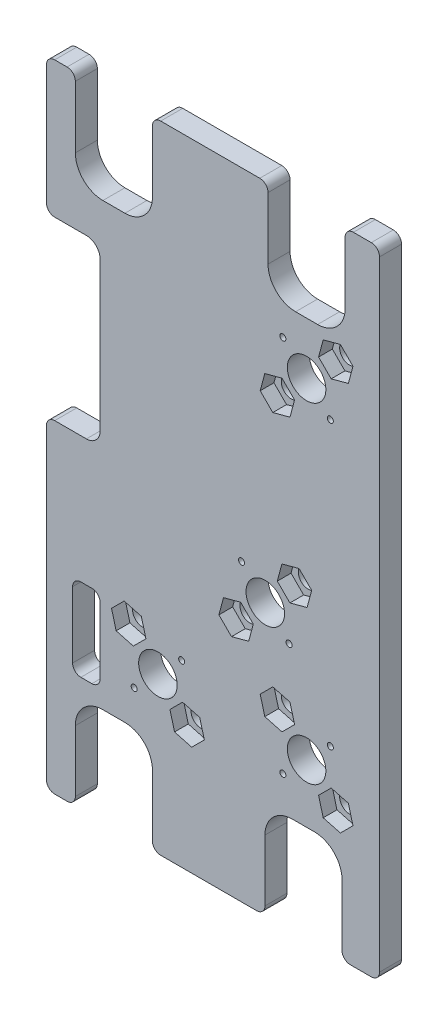
from build123d import *

# Parameters (mm, degrees)
SKETCH1_W           = 5
SKETCH1_H           = 15
SKETCH1_R           = 0.55
SKETCH1_R_2         = 3.5
BOSS_EXTRUDE1_DEPTH = 4
SKETCH2_R           = 1.8
CUT_EXTRUDE1_DEPTH  = 2.5
SKETCH4_R           = 1.8
CUT_EXTRUDE2_DEPTH  = 131.110049573
FILLET1_R           = 5
FILLET2_R           = 2.5
FILLET3_R           = 1.5
FILLET4_R           = 1.5


with BuildPart() as part:
    # Sketch1 → Boss-Extrude1 (new body)
    with BuildSketch(Plane.XY):
        Polygon((5.00009906, -115.25), (5.00009906, -111.60004858), (5.00009906, -97.60004858), (19.00009906, -97.60004858), (19.00009906, -111.60004858), (19.00009906, -115.25), (39.43509906, -115.25), (39.43509906, -111.60004858), (39.43509906, -97.60004858), (53.43509906, -97.60004858), (53.43509906, -111.60004858), (53.43509906, -115.25), (60.25, -115.25), (60.25, 0.25), (54.00009906, 0.25), (54.00009906, -3.50006858), (54.00009906, -17.50006858), (40.00009906, -17.50006858), (40.00009906, -3.50006858), (40.00009906, 0.25), (19.00009906, 0.25), (19.00009906, -3.50006858), (19.00009906, -17.50006858), (5.00009906, -17.50006858), (5.00009906, -3.50006858), (5.00009906, 0.25), (-0.25, 0.25), (-0.25, -24.5), (4.5, -24.5), (9.5, -24.5), (9.5, -41.5), (9.5, -56.5), (4.5, -56.5), (-0.25, -56.5), (-0.25, -115.25), align=None)
        with Locations((7, -87)):
            Rectangle(SKETCH1_W, SKETCH1_H, mode=Mode.SUBTRACT)
        with Locations((15.686582595, -91.313399625)):
            Circle(SKETCH1_R, mode=Mode.SUBTRACT)
        with Locations((19.99993396, -87.00004826)):
            Circle(SKETCH1_R_2, mode=Mode.SUBTRACT)
        with Locations((24.313285325, -82.686696895)):
            Circle(SKETCH1_R, mode=Mode.SUBTRACT)
        with Locations((42.686582595, -91.313399625)):
            Circle(SKETCH1_R, mode=Mode.SUBTRACT)
        with Locations((46.99993396, -87.00004826)):
            Circle(SKETCH1_R_2, mode=Mode.SUBTRACT)
        with Locations((35.186582595, -61.686696895)):
            Circle(SKETCH1_R, mode=Mode.SUBTRACT)
        with Locations((39.49993396, -66.00004826)):
            Circle(SKETCH1_R_2, mode=Mode.SUBTRACT)
        with Locations((43.813285325, -70.313399625)):
            Circle(SKETCH1_R, mode=Mode.SUBTRACT)
        with Locations((51.313285325, -82.686696895)):
            Circle(SKETCH1_R, mode=Mode.SUBTRACT)
        with Locations((51.313285325, -31.313399625)):
            Circle(SKETCH1_R, mode=Mode.SUBTRACT)
        with Locations((42.686582595, -22.686696895)):
            Circle(SKETCH1_R, mode=Mode.SUBTRACT)
        with Locations((46.99993396, -27.00004826)):
            Circle(SKETCH1_R_2, mode=Mode.SUBTRACT)
    extrude(amount=BOSS_EXTRUDE1_DEPTH)

    # Sketch2 → Cut-Extrude1 (cut)
    # profile 1 of 8: a face of its own
    with BuildSketch(Plane.XY.offset(4)):
        Polygon((26.140038593, -95.42634332), (28.42622902, -93.140152893), (27.589425245, -90.017158692), (24.466431045, -89.180354918), (22.180240618, -91.466545345), (23.017044392, -94.589539545), align=None)
        with Locations((25.303234819, -92.303349119)):
            Circle(SKETCH2_R, mode=Mode.SUBTRACT)
    # profile 2 of 8: a face of its own
    with BuildSketch(Plane.XY.offset(4)):
        Polygon((13.859829327, -78.5737532), (11.5736389, -80.859943627), (12.410442675, -83.982937828), (15.533436875, -84.819741602), (17.819627302, -82.533551175), (16.982823528, -79.410556975), align=None)
        with Locations((14.696633101, -81.696747401)):
            Circle(SKETCH2_R, mode=Mode.SUBTRACT)
    # profile 3 of 8: a face of its own
    with BuildSketch(Plane.XY.offset(4)):
        Polygon((53.140038593, -95.42634332), (55.42622902, -93.140152893), (54.589425245, -90.017158692), (51.466431045, -89.180354918), (49.180240618, -91.466545345), (50.017044392, -94.589539545), align=None)
        with Locations((52.303234819, -92.303349119)):
            Circle(SKETCH2_R, mode=Mode.SUBTRACT)
    # profile 4 of 8: a face of its own
    with BuildSketch(Plane.XY.offset(4)):
        Polygon((38.5736389, -80.859943627), (39.410442675, -83.982937828), (42.533436875, -84.819741602), (44.819627302, -82.533551175), (43.982823528, -79.410556975), (40.859829327, -78.5737532), align=None)
        with Locations((41.696633101, -81.696747401)):
            Circle(SKETCH2_R, mode=Mode.SUBTRACT)
    # profile 5 of 8: a face of its own
    with BuildSketch(Plane.XY.offset(4)):
        Polygon((31.0736389, -72.140152893), (33.359829327, -74.42634332), (36.482823528, -73.589539545), (37.319627302, -70.466545345), (35.033436875, -68.180354918), (31.910442675, -69.017158692), align=None)
        with Locations((34.196633101, -71.303349119)):
            Circle(SKETCH2_R, mode=Mode.SUBTRACT)
    # profile 6 of 8: a face of its own
    with BuildSketch(Plane.XY.offset(4)):
        Polygon((47.92622902, -59.859943627), (45.640038593, -57.5737532), (42.517044392, -58.410556975), (41.680240618, -61.533551175), (43.966431045, -63.819741602), (47.089425245, -62.982937828), align=None)
        with Locations((44.803234819, -60.696747401)):
            Circle(SKETCH2_R, mode=Mode.SUBTRACT)
    # profile 7 of 8: a face of its own
    with BuildSketch(Plane.XY.offset(4)):
        Polygon((44.819627302, -31.466545345), (42.533436875, -29.180354918), (39.410442675, -30.017158692), (38.5736389, -33.140152893), (40.859829327, -35.42634332), (43.982823528, -34.589539545), align=None)
        with Locations((41.696633101, -32.303349119)):
            Circle(SKETCH2_R, mode=Mode.SUBTRACT)
    # profile 8 of 8: a face of its own
    with BuildSketch(Plane.XY.offset(4)):
        Polygon((54.589425245, -23.982937828), (55.42622902, -20.859943627), (53.140038593, -18.5737532), (50.017044392, -19.410556975), (49.180240618, -22.533551175), (51.466431045, -24.819741602), align=None)
        with Locations((52.303234819, -21.696747401)):
            Circle(SKETCH2_R, mode=Mode.SUBTRACT)
    extrude(amount=-CUT_EXTRUDE1_DEPTH, mode=Mode.SUBTRACT)

    # Sketch4 → Cut-Extrude2 (cut, through all)
    with BuildSketch(Plane.XY.offset(4)):
        with Locations((52.303234819, -21.696747401)):
            Circle(SKETCH4_R)
        with Locations((41.696633101, -32.303349119)):
            Circle(SKETCH4_R)
        with Locations((44.803234819, -60.696747401)):
            Circle(SKETCH4_R)
        with Locations((34.196633101, -71.303349119)):
            Circle(SKETCH4_R)
        with Locations((41.696633101, -81.696747401)):
            Circle(SKETCH4_R)
        with Locations((52.303234819, -92.303349119)):
            Circle(SKETCH4_R)
        with Locations((25.303234819, -92.303349119)):
            Circle(SKETCH4_R)
        with Locations((14.696633101, -81.696747401)):
            Circle(SKETCH4_R)
    extrude(amount=-CUT_EXTRUDE2_DEPTH, mode=Mode.SUBTRACT)

    # Fillet1
    fillet1_edges = [part.edges().sort_by_distance(p)[0] for p in [
        (53.43509906, -97.60004858, 2),
        (39.43509906, -97.60004858, 2),
        (19.00009906, -97.60004858, 2),
        (5.00009906, -97.60004858, 2),
        (5.00009906, -17.50006858, 2),
        (19.00009906, -17.50006858, 2),
        (40.00009906, -17.50006858, 2),
        (54.00009906, -17.50006858, 2),
    ]]
    fillet(fillet1_edges, radius=FILLET1_R)

    # Fillet2
    fillet2_edges = [part.edges().sort_by_distance(p)[0] for p in [
        (9.5, -56.5, 2),
        (9.5, -24.5, 2),
    ]]
    fillet(fillet2_edges, radius=FILLET2_R)

    # Fillet3
    fillet3_edges = [part.edges().sort_by_distance(p)[0] for p in [
        (4.5, -94.5, 2),
        (9.5, -94.5, 2),
        (9.5, -79.5, 2),
        (4.5, -79.5, 2),
    ]]
    fillet(fillet3_edges, radius=FILLET3_R)

    # Fillet4
    fillet4_edges = [part.edges().sort_by_distance(p)[0] for p in [
        (60.25, 0.25, 2),
        (60.25, -115.25, 2),
        (53.43509906, -115.25, 2),
        (39.43509906, -115.25, 2),
        (19.00009906, -115.25, 2),
        (5.00009906, -115.25, 2),
        (-0.25, -115.25, 2),
        (-0.25, -56.5, 2),
        (-0.25, -24.5, 2),
        (-0.25, 0.25, 2),
        (5.00009906, 0.25, 2),
        (19.00009906, 0.25, 2),
        (40.00009906, 0.25, 2),
        (54.00009906, 0.25, 2),
    ]]
    fillet(fillet4_edges, radius=FILLET4_R)


solid = part.part
